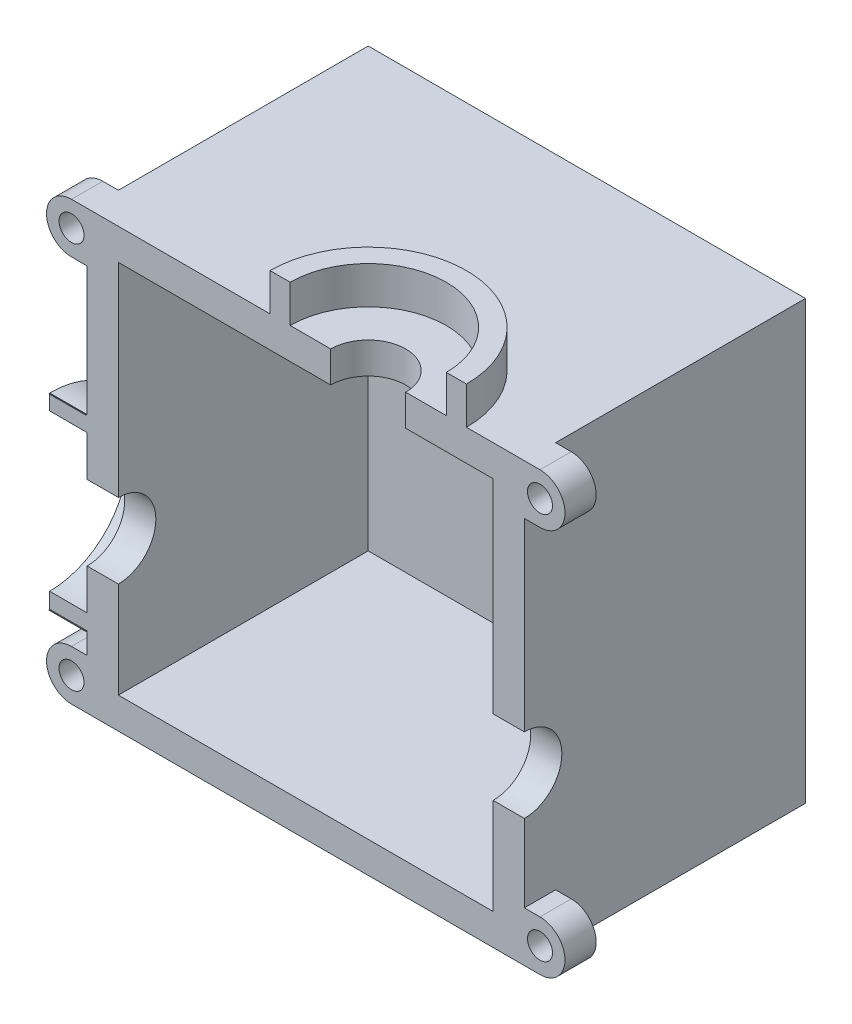
from build123d import *

# Parameters (mm, degrees)
SKETCH_1_W               = 90
SKETCH_1_H               = 90
EXTRUDE_2_DEPTH          = 45
SKETCH_2_W               = 80
SKETCH_2_H               = 80
CUT_EXTRUDE_1_DEPTH      = 40
EXTRUDE_3_DEPTH          = 10
SKETCH_4_R               = 1
EXTRUDE_4_DEPTH          = 2
SKETCH_5_R               = 6
CUT_EXTRUDE_2_DEPTH      = 30
EXTRUDE_5_DEPTH          = 6
CUT_EXTRUDE_START        = -2
CUT_EXTRUDE_3_DEPTH      = 6
SKETCH_8_R               = 12.5
CUT_EXTRUDE_4_DEPTH      = 6
SKETCH_9_R               = 6
CUT_EXTRUDE_5_DEPTH      = 500
SKETCH_10_R              = 2
EXTRUDE_6_DEPTH          = 5
CUT_EXTRUDE_6_DEPTH      = 86.393013363
CUT_EXTRUDE_6_DEPTH_BACK = 86.393013363
EXTRUDE_8_DEPTH          = 5
EXTRUDE_9_REACH          = 89.762
SKETCH_13_W              = 70
SKETCH_13_H              = 5
SKETCH_14_R              = 2
SKETCH_14_W              = 3.535716984
SKETCH_14_H              = 8
EXTRUDE_10_DEPTH         = 5
SKETCH_15_R              = 15
CUT_EXTRUDE_7_DEPTH      = 30
SKETCH_16_R              = 34.759531797
CUT_EXTRUDE_8_DEPTH      = 4
SKETCH_17_R              = 12.5
CUT_EXTRUDE_9_DEPTH      = 6
SKETCH_18_R              = 6
CUT_EXTRUDE_10_DEPTH     = 10
EXTRUDE_11_DEPTH         = 6


with BuildPart() as part:
    # 草图1 → 凸台-拉伸2 (new body)
    with BuildSketch(Plane.XY):
        Rectangle(SKETCH_1_W, SKETCH_1_H)
    extrude(amount=EXTRUDE_2_DEPTH)

    # 草图2 → 切除-拉伸1 (cut)
    with BuildSketch(Plane.XY.offset(45)):
        Rectangle(SKETCH_2_W, SKETCH_2_H)
    extrude(amount=-CUT_EXTRUDE_1_DEPTH, mode=Mode.SUBTRACT)

    # 草图3 → 凸台-拉伸3 (add)
    with BuildSketch(Plane(origin=(0, 45, 0), x_dir=(1, 0, 0), z_dir=(0, 1, 0))):
        with BuildLine():
            Line((-15.725, -45), (15.725, -45))
            ThreePointArc((15.725, -45), (0, -29.275), (-15.725, -45))
        make_face()
    extrude(amount=EXTRUDE_3_DEPTH)

    # 草图4 → 凸台-拉伸4 (add)
    with BuildSketch(Plane(origin=(0, 55, 0), x_dir=(1, 0, 0), z_dir=(0, 1, 0))):
        with BuildLine():
            Line((-13.344644505, -28.920245738), (13.344644505, -28.920245738))
            ThreePointArc((13.344644505, -28.920245738), (16.17307163, -30.091818614), (17.344644505, -32.920245738))
            Line((17.344644505, -32.920245738), (17.344644505, -45))
            Line((17.344644505, -45), (-17.344644505, -45))
            Line((-17.344644505, -45), (-17.344644505, -32.920245738))
            ThreePointArc((-17.344644505, -32.920245738), (-16.17307163, -30.091818614), (-13.344644505, -28.920245738))
        make_face()
        with Locations(Location((13.344644505, -32.920245738, 0), (0, 0, 270))):
            Circle(SKETCH_4_R, mode=Mode.SUBTRACT)
        with Locations(Location((-13.344644505, -32.920245738, 0), (0, 0, 270))):
            Circle(SKETCH_4_R, mode=Mode.SUBTRACT)
    extrude(amount=-EXTRUDE_4_DEPTH)

    # 草图5 → 切除-拉伸2 (cut)
    with BuildSketch(Plane(origin=(0, 55, 0), x_dir=(1, 0, 0), z_dir=(0, 1, 0))):
        with Locations((0, -45)):
            Circle(SKETCH_5_R)
    extrude(amount=-CUT_EXTRUDE_2_DEPTH, mode=Mode.SUBTRACT)

    # 草图6 → 凸台-拉伸5 (add)
    with BuildSketch(Plane.ZY.offset(45)):
        with BuildLine():
            Line((45.183538062, 16.4), (45.183538062, -13.6))
            ThreePointArc((45.183538062, -13.6), (30.183538062, 1.4), (45.183538062, 16.4))
        make_face()
    extrude(amount=EXTRUDE_5_DEPTH)

    # 草图7 → 切除-拉伸3 (cut)
    with BuildSketch(Plane(origin=(0, 55, 0), x_dir=(1, 0, 0), z_dir=(0, 1, 0)).offset(CUT_EXTRUDE_START)):
        with BuildLine():
            Line((-12.5, -45), (12.5, -45))
            ThreePointArc((12.5, -45), (0, -32.5), (-12.5, -45))
        make_face()
    extrude(amount=-CUT_EXTRUDE_3_DEPTH, mode=Mode.SUBTRACT)

    # 草图8 → 切除-拉伸4 (cut)
    with BuildSketch(Plane.ZY.offset(51)):
        with Locations((45.183538062, 1.4)):
            Circle(SKETCH_8_R)
    extrude(amount=-CUT_EXTRUDE_4_DEPTH, mode=Mode.SUBTRACT)

    # 草图9 → 切除-拉伸5 (cut)
    with BuildSketch(Plane.ZY.offset(45)):
        with Locations((45, 1.4)):
            Circle(SKETCH_9_R)
    extrude(amount=-CUT_EXTRUDE_5_DEPTH, mode=Mode.SUBTRACT)

    # 草图10 → 凸台-拉伸6 (add)
    # profile 1 of 4: a face of its own
    with BuildSketch(Plane.XY.offset(45)):
        with BuildLine():
            Line((-47.5, 45), (-42.902808048, 45))
            Line((-42.902808048, 45), (-42.902808048, 37))
            Line((-42.902808048, 37), (-47.5, 37))
            ThreePointArc((-47.5, 37), (-51.5, 41), (-47.5, 45))
        make_face()
        with Locations((-47.5, 41)):
            Circle(SKETCH_10_R, mode=Mode.SUBTRACT)
    # profile 2 of 4: a face of its own
    with BuildSketch(Plane.XY.offset(45)):
        with BuildLine():
            Line((-47.5, -45), (-42.902808048, -45))
            Line((-42.902808048, -45), (-42.902808048, -37))
            Line((-42.902808048, -37), (-47.5, -37))
            ThreePointArc((-47.5, -37), (-51.5, -41), (-47.5, -45))
        make_face()
        with Locations((-47.5, -41)):
            Circle(SKETCH_10_R, mode=Mode.SUBTRACT)
    # profile 3 of 4: a face of its own
    with BuildSketch(Plane.XY.offset(45)):
        with BuildLine():
            Line((42.460881889, 45), (42.460881889, 37))
            Line((42.460881889, 37), (47.5, 37))
            ThreePointArc((47.5, 37), (51.5, 41), (47.5, 45))
            Line((47.5, 45), (42.460881889, 45))
        make_face()
        with Locations((47.5, 41)):
            Circle(SKETCH_10_R, mode=Mode.SUBTRACT)
    # profile 4 of 4: a face of its own
    with BuildSketch(Plane.XY.offset(45)):
        with BuildLine():
            Line((41.065096799, -37), (41.065096799, -45))
            Line((41.065096799, -45), (47.5, -45))
            ThreePointArc((47.5, -45), (51.5, -41), (47.5, -37))
            Line((47.5, -37), (41.065096799, -37))
        make_face()
        with Locations((47.5, -41)):
            Circle(SKETCH_10_R, mode=Mode.SUBTRACT)
    extrude(amount=-EXTRUDE_6_DEPTH)

    # 草图11 → 切除-拉伸6 (cut, two sides: drawn at the far end of the back side and taken through both)
    with BuildSketch(Plane.XY.offset(5).offset(-CUT_EXTRUDE_6_DEPTH_BACK)):
        Polygon((25, 25), (25, 60.762211799), (85.89289348, 60.762211799), (85.89289348, -73.939659246), (-86.710921037, -73.939659246), (-86.710921037, -25), (-25, -25), (25, -25), align=None)
    extrude(amount=CUT_EXTRUDE_6_DEPTH + CUT_EXTRUDE_6_DEPTH_BACK, mode=Mode.SUBTRACT)

    # 草图12 → 凸台-拉伸8 (add)
    with BuildSketch(Plane(origin=(25, 0, 0), x_dir=(0, 0, -1), z_dir=(1, 0, 0))):
        Polygon((-45, 40), (-45, -25), (-5, -25), (0, -25), (0, 45), (-45, 45), align=None)
    extrude(amount=-EXTRUDE_8_DEPTH)

    # 草图13 → 凸台-拉伸9 (add, up to next)
    with BuildSketch(Plane.XY.offset(45), mode=Mode.PRIVATE) as extrude_9_sk1:
        with Locations((-10, -22.5)):
            Rectangle(SKETCH_13_W, SKETCH_13_H)
    extrude_9_tool1 = extrude(extrude_9_sk1.sketch, amount=-EXTRUDE_9_REACH, mode=Mode.PRIVATE) - part.part
    add(extrude_9_tool1.solids().sort_by_distance((-10, -22.5, 45))[0])

    # 草图14 → 凸台-拉伸10 (add)
    # profile 1 of 5: a face of its own
    with BuildSketch(Plane.XY.offset(45)):
        with BuildLine():
            Line((27.5, 45), (25, 45))
            Line((25, 45), (25, 37))
            Line((25, 37), (27.5, 37))
            ThreePointArc((27.5, 37), (31.5, 41), (27.5, 45))
        make_face()
        with Locations((27.5, 41)):
            Circle(SKETCH_14_R, mode=Mode.SUBTRACT)
    # profile 2 of 5: a face of its own
    with BuildSketch(Plane.XY.offset(45)):
        with Locations((-43.232141508, -21)):
            Rectangle(SKETCH_14_W, SKETCH_14_H)
    # profile 3 of 5: a face of its own
    with BuildSketch(Plane.XY.offset(45)):
        with Locations((23.232141508, -21)):
            Rectangle(SKETCH_14_W, SKETCH_14_H)
    # profile 4 of 5: a face of its own
    with BuildSketch(Plane.XY.offset(45)):
        with BuildLine():
            Line((27.5, -17), (25, -17))
            Line((25, -17), (25, -25))
            Line((25, -25), (27.5, -25))
            ThreePointArc((27.5, -25), (31.5, -21), (27.5, -17))
        make_face()
        with Locations((27.5, -21)):
            Circle(SKETCH_14_R, mode=Mode.SUBTRACT)
    # profile 5 of 5: a face of its own
    with BuildSketch(Plane.XY.offset(45)):
        with BuildLine():
            Line((-47.5, -25), (-45, -25))
            Line((-45, -25), (-45, -17))
            Line((-45, -17), (-47.5, -17))
            ThreePointArc((-47.5, -17), (-51.5, -21), (-47.5, -25))
        make_face()
        with Locations((-47.5, -21)):
            Circle(SKETCH_14_R, mode=Mode.SUBTRACT)
    extrude(amount=-EXTRUDE_10_DEPTH)

    # 草图15 → 切除-拉伸7 (cut)
    with BuildSketch(Plane.ZY.offset(45)):
        with Locations((45, 1.4)):
            Circle(SKETCH_15_R)
    extrude(amount=CUT_EXTRUDE_7_DEPTH, mode=Mode.SUBTRACT)


with BuildPart() as cut_extrude_7_piece_1:
    # of the separate pieces the step leaves, piece 1, a body of its own (cut_extrude_7_pieces)
    add(part.part.solids().sort_by_distance((-45, 45, 0))[0])

    # 草图16 → 切除-拉伸8 (cut)
    with BuildSketch(Plane(origin=(0, 55, 0), x_dir=(1, 0, 0), z_dir=(0, 1, 0))):
        with Locations((0, -45)):
            Circle(SKETCH_16_R)
    extrude(amount=-CUT_EXTRUDE_8_DEPTH, mode=Mode.SUBTRACT)

    # 草图17 → 切除-拉伸9 (cut)
    with BuildSketch(Plane(origin=(0, 51, 0), x_dir=(1, 0, 0), z_dir=(0, 1, 0))):
        with Locations((0, -45)):
            Circle(SKETCH_17_R)
    extrude(amount=-CUT_EXTRUDE_9_DEPTH, mode=Mode.SUBTRACT)

    # 草图18 → 切除-拉伸10 (cut)
    with BuildSketch(Plane.ZY.offset(-20)):
        with Locations((45, 1.4)):
            Circle(SKETCH_18_R)
    extrude(amount=-CUT_EXTRUDE_10_DEPTH, mode=Mode.SUBTRACT)

    # 草图19 → 凸台-拉伸11 (add)
    with BuildSketch(Plane.ZY.offset(45)):
        with BuildLine():
            Line((45, 16.4), (45, 13.9))
            ThreePointArc((45, 13.9), (32.5, 1.4), (45, -11.1))
            Line((45, -11.1), (45, -13.6))
            ThreePointArc((45, -13.6), (30, 1.4), (45, 16.4))
        make_face()
    extrude(amount=EXTRUDE_11_DEPTH)


with BuildPart() as cut_extrude_7_piece_2:
    # of the separate pieces the step leaves, piece 2, a body of its own (cut_extrude_7_pieces)
    add(part.part.solids().sort_by_distance((-45, -13.599719279, 45.091769031))[0])


with BuildPart() as cut_extrude_7_piece_3:
    # of the separate pieces the step leaves, piece 3, a body of its own (cut_extrude_7_pieces)
    add(part.part.solids().sort_by_distance((-45, 16.398877084, 45.183538062))[0])


solid = Compound([cut_extrude_7_piece_1.part, cut_extrude_7_piece_2.part, cut_extrude_7_piece_3.part])
